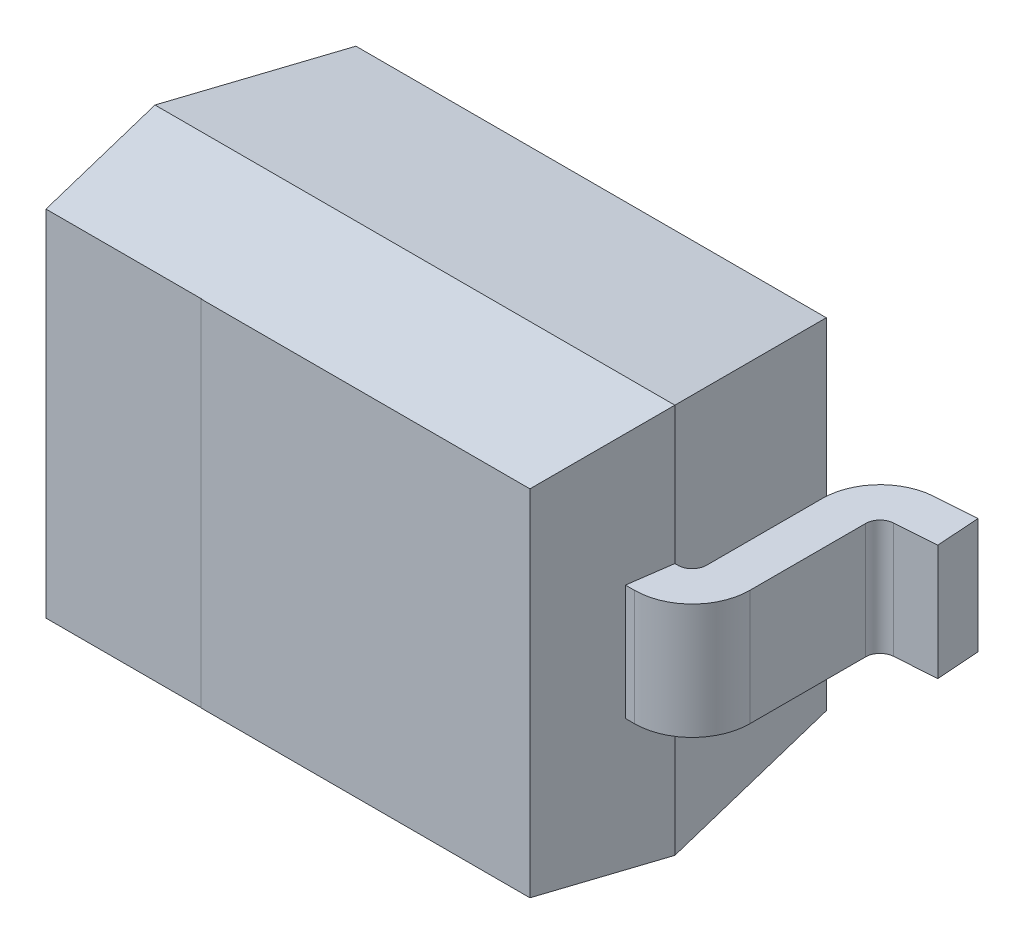
from build123d import *

# Parameters (mm, degrees)
BOSS_EXTRUDE1_DEPTH     = 2.5
CUT_EXTRUDE1_DEPTH      = 3.875760769
CUT_EXTRUDE1_DEPTH_BACK = 3.875760769
SKETCH4_OUTSIDE_W       = 4.134
SKETCH4_OUTSIDE_H       = 8.084
BOSS_EXTRUDE2_DEPTH     = 0.2
SKETCH5_W               = 0.6
SKETCH5_H               = 1.35
CUT_EXTRUDE2_DEPTH      = 0.001


with BuildPart() as part:
    # Sketch2 → Boss-Extrude1 (new, symmetric)
    with BuildSketch(Plane(origin=(0, 0, 0), x_dir=(1, 0, 0), z_dir=(0, 1, 0))):
        Polygon((-0.814270091, -0.05), (-0.9, -0.66), (-0.838162033, -1.1), (0.838162033, -1.1), (0.9, -0.66), (0.814270091, -0.05), align=None)
    extrude(amount=BOSS_EXTRUDE1_DEPTH, both=True)

    # Sketch4 outside → Cut-Extrude1 (cut, two sides: drawn at the far end of the back side and taken through both)
    with BuildSketch(Plane(origin=(0, 0, 0), x_dir=(0, 0, -1), z_dir=(1, 0, 0)).offset(-CUT_EXTRUDE1_DEPTH_BACK)):
        with Locations((-0.575, 0)):
            Rectangle(SKETCH4_OUTSIDE_W, SKETCH4_OUTSIDE_H)
        Polygon((-0.05, -0.589270091), (-0.66, -0.675), (-1.1, -0.613162033), (-1.1, 0.613162033), (-0.66, 0.675), (-0.05, 0.589270091), align=None, mode=Mode.SUBTRACT)
    extrude(amount=CUT_EXTRUDE1_DEPTH + CUT_EXTRUDE1_DEPTH_BACK, mode=Mode.SUBTRACT)

    # Sketch3 → Boss-Extrude2 (add, symmetric)
    with BuildSketch(Plane(origin=(0, 0, 0), x_dir=(1, 0, 0), z_dir=(0, 1, 0))):
        with BuildLine():
            Line((-0.878918875, -0.81), (-0.9, -0.66))
            Line((-0.9, -0.66), (-0.91, -0.66))
            ThreePointArc((-0.91, -0.66), (-0.945355339, -0.645355339), (-0.96, -0.61))
            Line((-0.96, -0.61), (-0.96, -0.209546456))
            ThreePointArc((-0.96, -0.209546456), (-1.01372926, -0.073146784), (-1.146048705, -0.010033646))
            Line((-1.146048705, -0.010033646), (-1.289536529, 0))
            Line((-1.289536529, 0), (-1.3, -0.149634608))
            Line((-1.3, -0.149634608), (-1.156512176, -0.159668254))
            ThreePointArc((-1.156512176, -0.159668254), (-1.123432315, -0.175446538), (-1.11, -0.209546456))
            Line((-1.11, -0.209546456), (-1.11, -0.61))
            ThreePointArc((-1.11, -0.61), (-1.051421356, -0.751421356), (-0.91, -0.81))
            Line((-0.91, -0.81), (-0.878918875, -0.81))
        make_face()
    boss_extrude2 = extrude(amount=BOSS_EXTRUDE2_DEPTH, both=True)

    # Mirror1: Boss-Extrude2 across plane
    add(boss_extrude2.mirror(Plane(origin=(0, 0, 0), x_dir=(0, 0, 1), z_dir=(1, 0, 0))))

    # Sketch5 → Cut-Extrude2 (cut)
    with BuildSketch(Plane.XY.offset(1.1)):
        with Locations((-0.6, 0)):
            Rectangle(SKETCH5_W, SKETCH5_H)
    extrude(amount=-CUT_EXTRUDE2_DEPTH, mode=Mode.SUBTRACT)


solid = part.part
